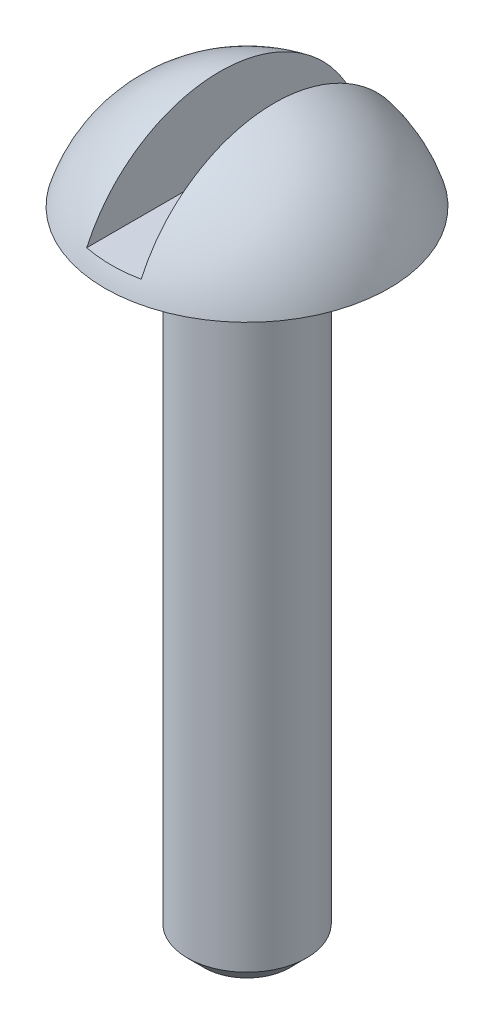
from build123d import *

# Parameters (mm, degrees)
SKETCH3_R           = 0.889
BOSS_EXTRUDE1_DEPTH = 9.525
CHAMFER1_SIZE       = 0.254
CUT_EXTRUDE1_START  = 0.254
SKETCH4_W           = 0.8128
SKETCH4_H           = 4.2418
CUT_EXTRUDE1_DEPTH  = 10.732093261


with BuildPart() as part:
    # Sketch2 → Revolve1 (revolve)
    with BuildSketch(Plane(origin=(0, 0, 0), x_dir=(0, 0, -1), z_dir=(1, 0, 0))):
        with BuildLine():
            Line((0, 0), (2.1209, 0))
            ThreePointArc((2.1209, 0), (1.320815264, 1.138053219), (0, 1.5748))
            Line((0, 1.5748), (0, 0))
        make_face()
    revolve(axis=Axis((0, 0.415157056, 0), (0, -1, 0)))

    # Sketch3 → Boss-Extrude1 (add)
    with BuildSketch(Plane.XZ):
        with Locations(Location((0, 0, 0), (0, 0, 90))):
            Circle(SKETCH3_R)
    extrude(amount=BOSS_EXTRUDE1_DEPTH)

    # Chamfer1
    chamfer1_edges = [part.edges().sort_by_distance(p)[0] for p in [
        (0, -9.525, -0.889),
    ]]
    chamfer(chamfer1_edges, length=CHAMFER1_SIZE)

    # Sketch4 → Cut-Extrude1 (cut, through all)
    with BuildSketch(Plane(origin=(0, 0, 0), x_dir=(1, 0, 0), z_dir=(0, 1, 0)).offset(CUT_EXTRUDE1_START)):
        Rectangle(SKETCH4_W, SKETCH4_H)
    extrude(amount=CUT_EXTRUDE1_DEPTH, mode=Mode.SUBTRACT)


solid = part.part
